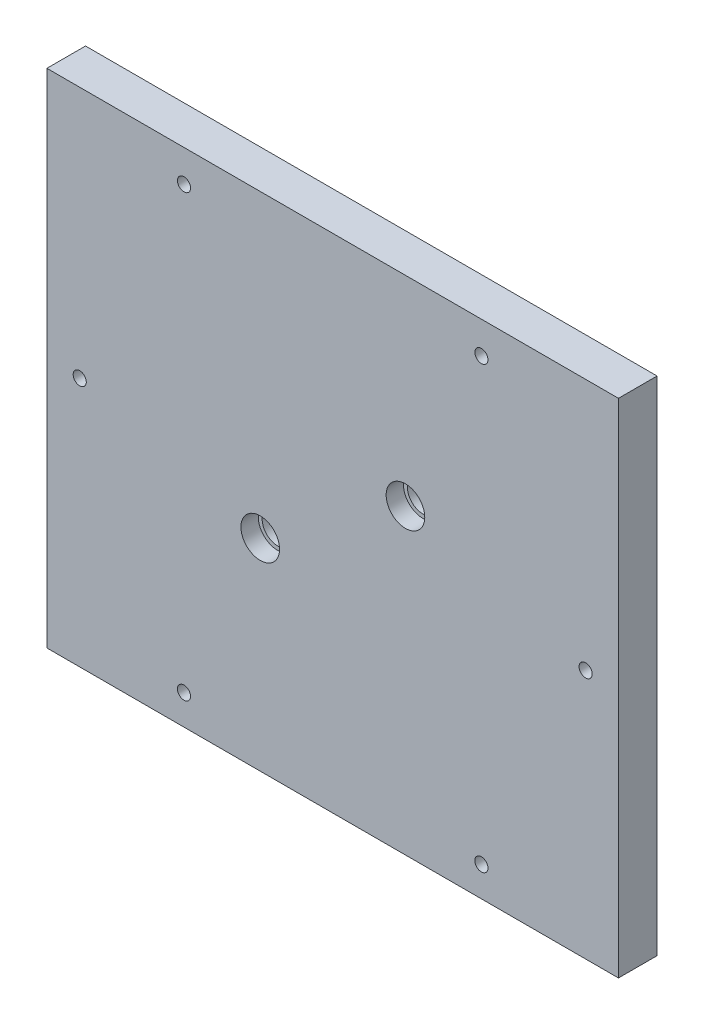
from build123d import *

# Parameters (mm, degrees)
ESBO_O1_W                  = 148
ESBO_O1_H                  = 130
RESSALTO_EXTRUS_O1_DEPTH   = 10
FURO_COM_FOLGA_DE_M3X0_5_D = 3.4
ESBO_O5_R                  = 5
CORTE_EXTRUS_O1_DEPTH      = 4.5
CORTE_EXTRUS_O2_REACH      = 205.463
ESBO_O6_R                  = 4


with BuildPart() as part:
    # Esboço1 → Ressalto-extrusão1 (new body)
    with BuildSketch(Plane.XY):
        with Locations((-0.0034, 124.2634)):
            Rectangle(ESBO_O1_W, ESBO_O1_H)
    extrude(amount=RESSALTO_EXTRUS_O1_DEPTH)

    # Furo com folga de M3X0.5 (through all)
    with Locations(Plane.XY.offset(10)):
        with Locations((38.5, 67), (-38.5068, 67), (65.5, 124), (-65.5068, 124), (-38.5068, 181), (38.5, 181)):
            Hole(FURO_COM_FOLGA_DE_M3X0_5_D / 2)

    # Esboço5 → Corte-extrusão1 (cut)
    with BuildSketch(Plane.XY.offset(10)):
        with Locations((-18.7634, 111.5234)):
            Circle(ESBO_O5_R)
        with Locations((18.8366, 137.5034)):
            Circle(ESBO_O5_R)
    extrude(amount=-CORTE_EXTRUS_O1_DEPTH, mode=Mode.SUBTRACT)

    # Esboço6 → Corte-extrusão2 (cut, up to next)
    with BuildSketch(Plane.XY.offset(10), mode=Mode.PRIVATE) as corte_extrus_o2_sk1:
        with Locations((-18.7634, 111.5234)):
            Circle(ESBO_O6_R)
    corte_extrus_o2_tool1 = extrude(corte_extrus_o2_sk1.sketch, amount=-CORTE_EXTRUS_O2_REACH, mode=Mode.PRIVATE) & part.part
    # Esboço6 → Corte-extrusão2 (cut, up to next)
    with BuildSketch(Plane.XY.offset(10), mode=Mode.PRIVATE) as corte_extrus_o2_sk2:
        with Locations((18.8366, 137.5034)):
            Circle(ESBO_O6_R)
    corte_extrus_o2_tool2 = extrude(corte_extrus_o2_sk2.sketch, amount=-CORTE_EXTRUS_O2_REACH, mode=Mode.PRIVATE) & part.part
    add(corte_extrus_o2_tool1.solids().sort_by_distance((-18.7634, 111.5234, 10))[0], mode=Mode.SUBTRACT)
    add(corte_extrus_o2_tool2.solids().sort_by_distance((18.8366, 137.5034, 10))[0], mode=Mode.SUBTRACT)


solid = part.part
